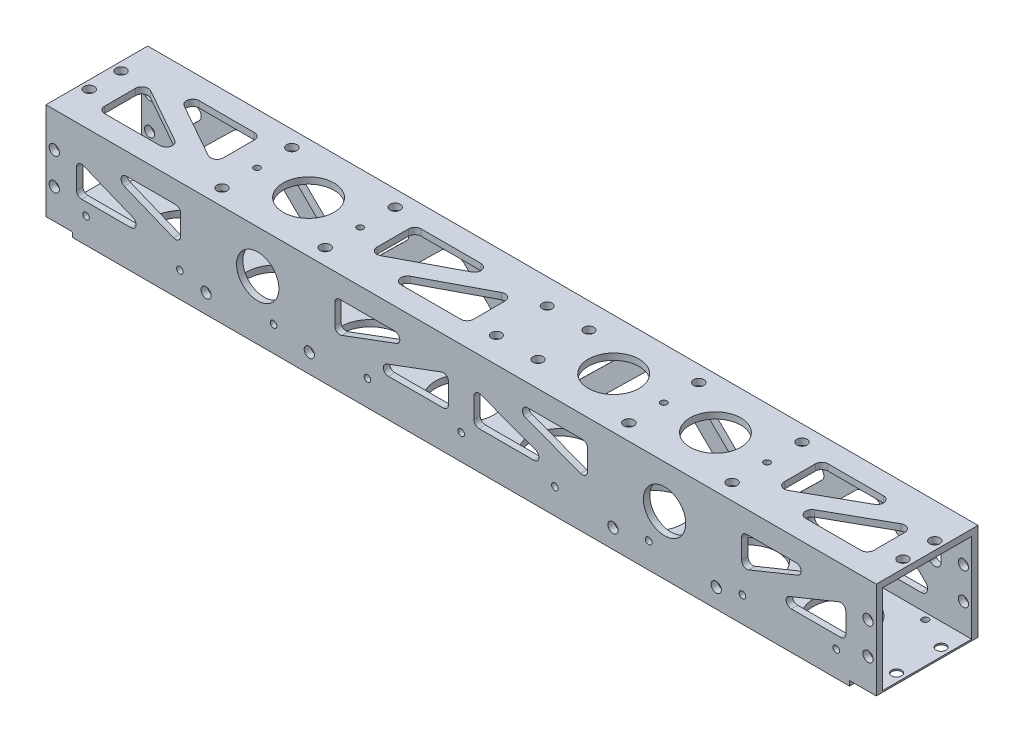
from build123d import *

# Parameters (mm, degrees)
SKETCH1_W                   = 50.8
SKETCH1_H                   = 50.8
SKETCH1_W_2                 = 44.45
SKETCH1_H_2                 = 44.45
BOSS_EXTRUDE1_DEPTH         = 207.3275
CUT_EXTRUDE1_DEPTH          = 211.416283249
CUT_EXTRUDE1_DEPTH_BACK     = 211.416283249
SKETCH2_W                   = 13.335
SKETCH2_H                   = 2.413
F_10_CLEARANCE_HOLE1_REACH  = 216.966
F_10_CLEARANCE_HOLE1_BORE_R = 2.5527
F_10_CLEARANCE_HOLE2_D      = 5.1054
F_10_CLEARANCE_HOLE2_DEPTH  = 3.175
F_10_CLEARANCE_HOLE3_D      = 5.1054
F_10_CLEARANCE_HOLE3_DEPTH  = 3.175
F_10_CLEARANCE_HOLE4_D      = 5.1054
HOLE1_D                     = 3.2766
HOLE1_DEPTH                 = 3.175
HOLE1_TIP                   = 0.984389952
HOLE2_D                     = 3.2766
HOLE2_DEPTH                 = 3.175
CUT_EXTRUDE4_REACH          = 216.966
SKETCH19_R                  = 1.5748
F_10_CLEARANCE_HOLE5_D      = 4.9784
F_10_CLEARANCE_HOLE5_DEPTH  = 0.762
CUT_EXTRUDE5_REACH          = 216.966
SKETCH23_R                  = 2.4892
CUT_EXTRUDE7_REACH          = 216.966
FILLET1_R                   = 3.175
CUT_EXTRUDE8_REACH          = 216.966
FILLET2_R                   = 2.54
CUT_EXTRUDE9_REACH          = 216.966
FILLET3_R                   = 3.175
CUT_EXTRUDE10_REACH         = 216.966
SKETCH27_R                  = 14.605
SKETCH28_R                  = 12.7
CUT_EXTRUDE11_DEPTH         = 3.81
SKETCH29_R                  = 10.57275
CUT_EXTRUDE12_DEPTH         = 3.81


with BuildPart() as part:
    # Sketch1 → Boss-Extrude1 (new, symmetric)
    with BuildSketch(Plane(origin=(0, 0, 0), x_dir=(0, 0, -1), z_dir=(1, 0, 0))):
        Rectangle(SKETCH1_W, SKETCH1_H)
        Rectangle(SKETCH1_W_2, SKETCH1_H_2, mode=Mode.SUBTRACT)
    extrude(amount=BOSS_EXTRUDE1_DEPTH, both=True)

    # Sketch2 → Cut-Extrude1 (cut, two sides: drawn at the far end of the back side and taken through both)
    with BuildSketch(Plane.XY.offset(-CUT_EXTRUDE1_DEPTH_BACK)):
        with Locations((-200.66, -24.1935)):
            Rectangle(SKETCH2_W, SKETCH2_H)
        with Locations((200.66, -24.1935)):
            Rectangle(SKETCH2_W, SKETCH2_H)
    extrude(amount=CUT_EXTRUDE1_DEPTH + CUT_EXTRUDE1_DEPTH_BACK, mode=Mode.SUBTRACT)

    # #10 Clearance Hole1 bore → #10 Clearance Hole1 (cut, up to next)
    with BuildSketch(Plane(origin=(0, 25.4, 0), x_dir=(-1, 0, 0), z_dir=(0, 1, 0)), mode=Mode.PRIVATE) as f_10_clearance_hole1_sk1:
        with Locations((127.381, 17.4625)):
            Circle(F_10_CLEARANCE_HOLE1_BORE_R)
    f_10_clearance_hole1_tool1 = extrude(f_10_clearance_hole1_sk1.sketch, amount=-F_10_CLEARANCE_HOLE1_REACH, mode=Mode.PRIVATE) & part.part
    # #10 Clearance Hole1 bore → #10 Clearance Hole1 (cut, up to next)
    with BuildSketch(Plane(origin=(0, 25.4, 0), x_dir=(-1, 0, 0), z_dir=(0, 1, 0)), mode=Mode.PRIVATE) as f_10_clearance_hole1_sk2:
        with Locations((-127.381, -17.4625)):
            Circle(F_10_CLEARANCE_HOLE1_BORE_R)
    f_10_clearance_hole1_tool2 = extrude(f_10_clearance_hole1_sk2.sketch, amount=-F_10_CLEARANCE_HOLE1_REACH, mode=Mode.PRIVATE) & part.part
    # #10 Clearance Hole1 bore → #10 Clearance Hole1 (cut, up to next)
    with BuildSketch(Plane(origin=(0, 25.4, 0), x_dir=(-1, 0, 0), z_dir=(0, 1, 0)), mode=Mode.PRIVATE) as f_10_clearance_hole1_sk3:
        with Locations((-127.381, 17.4625)):
            Circle(F_10_CLEARANCE_HOLE1_BORE_R)
    f_10_clearance_hole1_tool3 = extrude(f_10_clearance_hole1_sk3.sketch, amount=-F_10_CLEARANCE_HOLE1_REACH, mode=Mode.PRIVATE) & part.part
    # #10 Clearance Hole1 bore → #10 Clearance Hole1 (cut, up to next)
    with BuildSketch(Plane(origin=(0, 25.4, 0), x_dir=(-1, 0, 0), z_dir=(0, 1, 0)), mode=Mode.PRIVATE) as f_10_clearance_hole1_sk4:
        with Locations((127.381, -17.4625)):
            Circle(F_10_CLEARANCE_HOLE1_BORE_R)
    f_10_clearance_hole1_tool4 = extrude(f_10_clearance_hole1_sk4.sketch, amount=-F_10_CLEARANCE_HOLE1_REACH, mode=Mode.PRIVATE) & part.part
    # #10 Clearance Hole1 bore → #10 Clearance Hole1 (cut, up to next)
    with BuildSketch(Plane(origin=(0, 25.4, 0), x_dir=(-1, 0, 0), z_dir=(0, 1, 0)), mode=Mode.PRIVATE) as f_10_clearance_hole1_sk5:
        with Locations((75.819, -17.4625)):
            Circle(F_10_CLEARANCE_HOLE1_BORE_R)
    f_10_clearance_hole1_tool5 = extrude(f_10_clearance_hole1_sk5.sketch, amount=-F_10_CLEARANCE_HOLE1_REACH, mode=Mode.PRIVATE) & part.part
    # #10 Clearance Hole1 bore → #10 Clearance Hole1 (cut, up to next)
    with BuildSketch(Plane(origin=(0, 25.4, 0), x_dir=(-1, 0, 0), z_dir=(0, 1, 0)), mode=Mode.PRIVATE) as f_10_clearance_hole1_sk6:
        with Locations((-75.819, 17.4625)):
            Circle(F_10_CLEARANCE_HOLE1_BORE_R)
    f_10_clearance_hole1_tool6 = extrude(f_10_clearance_hole1_sk6.sketch, amount=-F_10_CLEARANCE_HOLE1_REACH, mode=Mode.PRIVATE) & part.part
    # #10 Clearance Hole1 bore → #10 Clearance Hole1 (cut, up to next)
    with BuildSketch(Plane(origin=(0, 25.4, 0), x_dir=(-1, 0, 0), z_dir=(0, 1, 0)), mode=Mode.PRIVATE) as f_10_clearance_hole1_sk7:
        with Locations((-75.819, -17.4625)):
            Circle(F_10_CLEARANCE_HOLE1_BORE_R)
    f_10_clearance_hole1_tool7 = extrude(f_10_clearance_hole1_sk7.sketch, amount=-F_10_CLEARANCE_HOLE1_REACH, mode=Mode.PRIVATE) & part.part
    # #10 Clearance Hole1 bore → #10 Clearance Hole1 (cut, up to next)
    with BuildSketch(Plane(origin=(0, 25.4, 0), x_dir=(-1, 0, 0), z_dir=(0, 1, 0)), mode=Mode.PRIVATE) as f_10_clearance_hole1_sk8:
        with Locations((75.819, 17.4625)):
            Circle(F_10_CLEARANCE_HOLE1_BORE_R)
    f_10_clearance_hole1_tool8 = extrude(f_10_clearance_hole1_sk8.sketch, amount=-F_10_CLEARANCE_HOLE1_REACH, mode=Mode.PRIVATE) & part.part
    add(f_10_clearance_hole1_tool1.solids().sort_by_distance((-127.381, 25.4, 17.4625))[0], mode=Mode.SUBTRACT)
    add(f_10_clearance_hole1_tool2.solids().sort_by_distance((127.381, 25.4, -17.4625))[0], mode=Mode.SUBTRACT)
    add(f_10_clearance_hole1_tool3.solids().sort_by_distance((127.381, 25.4, 17.4625))[0], mode=Mode.SUBTRACT)
    add(f_10_clearance_hole1_tool4.solids().sort_by_distance((-127.381, 25.4, -17.4625))[0], mode=Mode.SUBTRACT)
    add(f_10_clearance_hole1_tool5.solids().sort_by_distance((-75.819, 25.4, -17.4625))[0], mode=Mode.SUBTRACT)
    add(f_10_clearance_hole1_tool6.solids().sort_by_distance((75.819, 25.4, 17.4625))[0], mode=Mode.SUBTRACT)
    add(f_10_clearance_hole1_tool7.solids().sort_by_distance((75.819, 25.4, -17.4625))[0], mode=Mode.SUBTRACT)
    add(f_10_clearance_hole1_tool8.solids().sort_by_distance((-75.819, 25.4, 17.4625))[0], mode=Mode.SUBTRACT)

    # #10 Clearance Hole2
    with Locations(Plane(origin=(0, 0, 25.4), x_dir=(-1, 0, 0), z_dir=(0, 0, 1))):
        with Locations((75.819, 15.875), (-127.381, 15.875), (127.381, 15.875), (-75.819, 15.875)):
            Hole(F_10_CLEARANCE_HOLE2_D / 2, depth=F_10_CLEARANCE_HOLE2_DEPTH)

    # #10 Clearance Hole3
    with Locations(Plane(origin=(0, 25.4, 0), x_dir=(1, 0, 0), z_dir=(0, 1, 0))):
        with Locations((203.2, 7.9375), (-203.2, -7.9375), (-203.2, 7.9375), (203.2, -7.9375)):
            Hole(F_10_CLEARANCE_HOLE3_D / 2, depth=F_10_CLEARANCE_HOLE3_DEPTH)

    # #10 Clearance Hole4 (through all)
    with Locations(Plane.XY.offset(25.4)):
        with Locations((203.2, -7.9375), (-203.2, 7.9375), (-203.2, -7.9375), (203.2, 7.9375)):
            Hole(F_10_CLEARANCE_HOLE4_D / 2)

    # Hole1
    with Locations(Plane(origin=(0, -25.4, 0), x_dir=(-1, 0, 0), z_dir=(0, -1, 0))):
        with Locations((-187.325, 19.05), (187.325, -19.05), (187.325, 19.05), (140.49375, -19.05), (140.49375, 19.05), (93.6625, -19.05), (93.6625, 19.05), (46.83125, -19.05), (46.83125, 19.05), (0, -19.05), (0, 19.05), (-46.83125, -19.05), (-46.83125, 19.05), (-93.6625, -19.05), (-93.6625, 19.05), (-140.49375, -19.05), (-140.49375, 19.05), (-187.325, -19.05)):
            Hole(HOLE1_D / 2, depth=HOLE1_DEPTH)
            with Locations((0, 0, -(HOLE1_DEPTH + HOLE1_TIP / 2))):  # 118° drill point
                Cone(0, HOLE1_D / 2, HOLE1_TIP, mode=Mode.SUBTRACT)

    # Hole2
    with Locations(Plane.XY.offset(25.4)):
        with Locations((-187.325, -12.7), (-140.49375, -12.7), (-93.6625, -12.7), (-46.83125, -12.7), (0, -12.7), (46.83125, -12.7), (93.6625, -12.7), (140.49375, -12.7), (187.325, -12.7)):
            Hole(HOLE2_D / 2, depth=HOLE2_DEPTH)

    # Sketch19 → Cut-Extrude4 (cut, up to next)
    with BuildSketch(Plane(origin=(0, 25.4, 0), x_dir=(1, 0, 0), z_dir=(0, 1, 0)), mode=Mode.PRIVATE) as cut_extrude4_sk1:
        with Locations(Location((127.381, 0, 0), (0, 0, 270))):
            Circle(SKETCH19_R)
    cut_extrude4_tool1 = extrude(cut_extrude4_sk1.sketch, amount=-CUT_EXTRUDE4_REACH, mode=Mode.PRIVATE) & part.part
    # Sketch19 → Cut-Extrude4 (cut, up to next)
    with BuildSketch(Plane(origin=(0, 25.4, 0), x_dir=(1, 0, 0), z_dir=(0, 1, 0)), mode=Mode.PRIVATE) as cut_extrude4_sk2:
        with Locations(Location((-127.381, 0, 0), (0, 0, 270))):
            Circle(SKETCH19_R)
    cut_extrude4_tool2 = extrude(cut_extrude4_sk2.sketch, amount=-CUT_EXTRUDE4_REACH, mode=Mode.PRIVATE) & part.part
    # Sketch19 → Cut-Extrude4 (cut, up to next)
    with BuildSketch(Plane(origin=(0, 25.4, 0), x_dir=(1, 0, 0), z_dir=(0, 1, 0)), mode=Mode.PRIVATE) as cut_extrude4_sk3:
        with Locations(Location((-75.819, 0, 0), (0, 0, 270))):
            Circle(SKETCH19_R)
    cut_extrude4_tool3 = extrude(cut_extrude4_sk3.sketch, amount=-CUT_EXTRUDE4_REACH, mode=Mode.PRIVATE) & part.part
    # Sketch19 → Cut-Extrude4 (cut, up to next)
    with BuildSketch(Plane(origin=(0, 25.4, 0), x_dir=(1, 0, 0), z_dir=(0, 1, 0)), mode=Mode.PRIVATE) as cut_extrude4_sk4:
        with Locations(Location((75.819, 0, 0), (0, 0, 270))):
            Circle(SKETCH19_R)
    cut_extrude4_tool4 = extrude(cut_extrude4_sk4.sketch, amount=-CUT_EXTRUDE4_REACH, mode=Mode.PRIVATE) & part.part
    add(cut_extrude4_tool1.solids().sort_by_distance((127.381, 25.4, 0))[0], mode=Mode.SUBTRACT)
    add(cut_extrude4_tool2.solids().sort_by_distance((-127.381, 25.4, 0))[0], mode=Mode.SUBTRACT)
    add(cut_extrude4_tool3.solids().sort_by_distance((-75.819, 25.4, 0))[0], mode=Mode.SUBTRACT)
    add(cut_extrude4_tool4.solids().sort_by_distance((75.819, 25.4, 0))[0], mode=Mode.SUBTRACT)

    # #10 Clearance Hole5
    with Locations(Plane(origin=(0, -22.987, 0), x_dir=(-1, 0, 0), z_dir=(0, -1, 0))):
        with Locations((-203.2, -11.1125), (-203.2, 11.1125), (203.2, -11.1125), (203.2, 11.1125)):
            Hole(F_10_CLEARANCE_HOLE5_D / 2, depth=F_10_CLEARANCE_HOLE5_DEPTH)

    # Sketch23 → Cut-Extrude5 (cut, up to next)
    with BuildSketch(Plane(origin=(0, 25.4, 0), x_dir=(1, 0, 0), z_dir=(0, 1, 0)), mode=Mode.PRIVATE) as cut_extrude5_sk1:
        with Locations(Location((25.7175, 12.7, 0), (0, 0, 270))):
            Circle(SKETCH23_R)
    cut_extrude5_tool1 = extrude(cut_extrude5_sk1.sketch, amount=-CUT_EXTRUDE5_REACH, mode=Mode.PRIVATE) & part.part
    # Sketch23 → Cut-Extrude5 (cut, up to next)
    with BuildSketch(Plane(origin=(0, 25.4, 0), x_dir=(1, 0, 0), z_dir=(0, 1, 0)), mode=Mode.PRIVATE) as cut_extrude5_sk2:
        with Locations(Location((25.7175, -12.7, 0), (0, 0, 270))):
            Circle(SKETCH23_R)
    cut_extrude5_tool2 = extrude(cut_extrude5_sk2.sketch, amount=-CUT_EXTRUDE5_REACH, mode=Mode.PRIVATE) & part.part
    # Sketch23 → Cut-Extrude5 (cut, up to next)
    with BuildSketch(Plane(origin=(0, 25.4, 0), x_dir=(1, 0, 0), z_dir=(0, 1, 0)), mode=Mode.PRIVATE) as cut_extrude5_sk3:
        with Locations(Location((4.8895, 12.7, 0), (0, 0, 270))):
            Circle(SKETCH23_R)
    cut_extrude5_tool3 = extrude(cut_extrude5_sk3.sketch, amount=-CUT_EXTRUDE5_REACH, mode=Mode.PRIVATE) & part.part
    # Sketch23 → Cut-Extrude5 (cut, up to next)
    with BuildSketch(Plane(origin=(0, 25.4, 0), x_dir=(1, 0, 0), z_dir=(0, 1, 0)), mode=Mode.PRIVATE) as cut_extrude5_sk4:
        with Locations(Location((4.8895, -12.7, 0), (0, 0, 270))):
            Circle(SKETCH23_R)
    cut_extrude5_tool4 = extrude(cut_extrude5_sk4.sketch, amount=-CUT_EXTRUDE5_REACH, mode=Mode.PRIVATE) & part.part
    add(cut_extrude5_tool1.solids().sort_by_distance((25.7175, 25.4, -12.7))[0], mode=Mode.SUBTRACT)
    add(cut_extrude5_tool2.solids().sort_by_distance((25.7175, 25.4, 12.7))[0], mode=Mode.SUBTRACT)
    add(cut_extrude5_tool3.solids().sort_by_distance((4.8895, 25.4, -12.7))[0], mode=Mode.SUBTRACT)
    add(cut_extrude5_tool4.solids().sort_by_distance((4.8895, 25.4, 12.7))[0], mode=Mode.SUBTRACT)

    # Sketch24 → Cut-Extrude7 (cut, up to next)
    with BuildSketch(Plane(origin=(0, 25.4, 0), x_dir=(1, 0, 0), z_dir=(0, 1, 0)), mode=Mode.PRIVATE) as cut_extrude7_sk1:
        Polygon((-53.600823693, -14.605), (-7.8105, -14.605), (-7.8105, 9.578178988), align=None)
    cut_extrude7_tool1 = extrude(cut_extrude7_sk1.sketch, amount=-CUT_EXTRUDE7_REACH, mode=Mode.PRIVATE) & part.part
    # Sketch24 → Cut-Extrude7 (cut, up to next)
    with BuildSketch(Plane(origin=(0, 25.4, 0), x_dir=(1, 0, 0), z_dir=(0, 1, 0)), mode=Mode.PRIVATE) as cut_extrude7_sk2:
        Polygon((-63.119, -9.578178988), (-63.119, 14.605), (-17.328676307, 14.605), align=None)
    cut_extrude7_tool2 = extrude(cut_extrude7_sk2.sketch, amount=-CUT_EXTRUDE7_REACH, mode=Mode.PRIVATE) & part.part
    # Sketch24 → Cut-Extrude7 (cut, up to next)
    with BuildSketch(Plane(origin=(0, 25.4, 0), x_dir=(1, 0, 0), z_dir=(0, 1, 0)), mode=Mode.PRIVATE) as cut_extrude7_sk3:
        Polygon((-192.0875, -14.605), (-149.157890279, -14.605), (-192.0875, 9.506868708), align=None)
    cut_extrude7_tool3 = extrude(cut_extrude7_sk3.sketch, amount=-CUT_EXTRUDE7_REACH, mode=Mode.PRIVATE) & part.part
    # Sketch24 → Cut-Extrude7 (cut, up to next)
    with BuildSketch(Plane(origin=(0, 25.4, 0), x_dir=(1, 0, 0), z_dir=(0, 1, 0)), mode=Mode.PRIVATE) as cut_extrude7_sk4:
        Polygon((-183.010609721, 14.605), (-140.081, 14.605), (-140.081, -9.506868708), align=None)
    cut_extrude7_tool4 = extrude(cut_extrude7_sk4.sketch, amount=-CUT_EXTRUDE7_REACH, mode=Mode.PRIVATE) & part.part
    # Sketch24 → Cut-Extrude7 (cut, up to next)
    with BuildSketch(Plane(origin=(0, 25.4, 0), x_dir=(1, 0, 0), z_dir=(0, 1, 0)), mode=Mode.PRIVATE) as cut_extrude7_sk5:
        Polygon((149.157890279, -14.605), (192.0875, -14.605), (192.0875, 9.506868708), align=None)
    cut_extrude7_tool5 = extrude(cut_extrude7_sk5.sketch, amount=-CUT_EXTRUDE7_REACH, mode=Mode.PRIVATE) & part.part
    # Sketch24 → Cut-Extrude7 (cut, up to next)
    with BuildSketch(Plane(origin=(0, 25.4, 0), x_dir=(1, 0, 0), z_dir=(0, 1, 0)), mode=Mode.PRIVATE) as cut_extrude7_sk6:
        Polygon((140.081, -9.506868708), (140.081, 14.605), (183.010609721, 14.605), align=None)
    cut_extrude7_tool6 = extrude(cut_extrude7_sk6.sketch, amount=-CUT_EXTRUDE7_REACH, mode=Mode.PRIVATE) & part.part
    add(cut_extrude7_tool1.solids().sort_by_distance((-23.073941, 25.4, 6.54394))[0], mode=Mode.SUBTRACT)
    add(cut_extrude7_tool2.solids().sort_by_distance((-47.855559, 25.4, -6.54394))[0], mode=Mode.SUBTRACT)
    add(cut_extrude7_tool3.solids().sort_by_distance((-177.77763, 25.4, 6.56771))[0], mode=Mode.SUBTRACT)
    add(cut_extrude7_tool4.solids().sort_by_distance((-154.39087, 25.4, -6.56771))[0], mode=Mode.SUBTRACT)
    add(cut_extrude7_tool5.solids().sort_by_distance((177.77763, 25.4, 6.56771))[0], mode=Mode.SUBTRACT)
    add(cut_extrude7_tool6.solids().sort_by_distance((154.39087, 25.4, -6.56771))[0], mode=Mode.SUBTRACT)

    # Fillet1
    fillet1_edges = [part.edges().sort_by_distance(p)[0] for p in [
        (-53.600823693, 23.8125, 14.605),
        (-7.8105, 23.8125, 14.605),
        (-7.8105, 23.8125, -9.578178988),
        (140.081, 23.8125, 9.506868708),
        (183.010609721, 23.8125, -14.605),
        (140.081, 23.8125, -14.605),
        (-149.157890279, 23.8125, 14.605),
        (-192.0875, 23.8125, -9.506868708),
        (-192.0875, 23.8125, 14.605),
        (-183.010609721, 23.8125, -14.605),
        (-140.081, 23.8125, 9.506868708),
        (-140.081, 23.8125, -14.605),
        (149.157890279, 23.8125, 14.605),
        (192.0875, 23.8125, 14.605),
        (192.0875, 23.8125, -9.506868708),
        (-63.119, 23.8125, 9.578178988),
        (-17.328676307, 23.8125, -14.605),
        (-63.119, 23.8125, -14.605),
    ]]
    fillet(fillet1_edges, radius=FILLET1_R)

    # Sketch25 → Cut-Extrude8 (cut, up to next)
    with BuildSketch(Plane.XY.offset(25.4), mode=Mode.PRIVATE) as cut_extrude8_sk1:
        Polygon((-192.0875, 9.806626724), (-151.882404543, -6.5405), (-192.0875, -6.5405), align=None)
    cut_extrude8_tool1 = extrude(cut_extrude8_sk1.sketch, amount=-CUT_EXTRUDE8_REACH, mode=Mode.PRIVATE) & part.part
    # Sketch25 → Cut-Extrude8 (cut, up to next)
    with BuildSketch(Plane.XY.offset(25.4), mode=Mode.PRIVATE) as cut_extrude8_sk2:
        Polygon((-180.286095457, 14.605), (-140.081, 14.605), (-140.081, -1.742126724), align=None)
    cut_extrude8_tool2 = extrude(cut_extrude8_sk2.sketch, amount=-CUT_EXTRUDE8_REACH, mode=Mode.PRIVATE) & part.part
    # Sketch25 → Cut-Extrude8 (cut, up to next)
    with BuildSketch(Plane.XY.offset(25.4), mode=Mode.PRIVATE) as cut_extrude8_sk3:
        Polygon((-50.384612712, -6.5405), (-6.35, -6.5405), (-6.35, 9.861654399), align=None)
    cut_extrude8_tool3 = extrude(cut_extrude8_sk3.sketch, amount=-CUT_EXTRUDE8_REACH, mode=Mode.PRIVATE) & part.part
    # Sketch25 → Cut-Extrude8 (cut, up to next)
    with BuildSketch(Plane.XY.offset(25.4), mode=Mode.PRIVATE) as cut_extrude8_sk4:
        Polygon((-63.119, -1.797154399), (-63.119, 14.605), (-19.084387288, 14.605), align=None)
    cut_extrude8_tool4 = extrude(cut_extrude8_sk4.sketch, amount=-CUT_EXTRUDE8_REACH, mode=Mode.PRIVATE) & part.part
    cut_extrude8_1 = cut_extrude8_tool1.solids().sort_by_distance((-178.685802, -1.091458, 25.4))[0]
    add(cut_extrude8_1, mode=Mode.SUBTRACT)
    cut_extrude8_2 = cut_extrude8_tool2.solids().sort_by_distance((-153.482698, 9.155958, 25.4))[0]
    add(cut_extrude8_2, mode=Mode.SUBTRACT)
    cut_extrude8_3 = cut_extrude8_tool3.solids().sort_by_distance((-21.028204, -1.073115, 25.4))[0]
    add(cut_extrude8_3, mode=Mode.SUBTRACT)
    cut_extrude8_4 = cut_extrude8_tool4.solids().sort_by_distance((-48.440796, 9.137615, 25.4))[0]
    add(cut_extrude8_4, mode=Mode.SUBTRACT)
    cut_extrude8 = cut_extrude8_1 + cut_extrude8_2 + cut_extrude8_3 + cut_extrude8_4  # Cut-Extrude8 as one shape, for the pattern or mirror that repeats it

    # Mirror1: Cut-Extrude8 across plane
    add(cut_extrude8.mirror(Plane(origin=(0, 0, 0), x_dir=(0, 0, 1), z_dir=(1, 0, 0))), mode=Mode.SUBTRACT)

    # Fillet2
    fillet2_edges = [part.edges().sort_by_distance(p)[0] for p in [
        (-192.0875, -6.5405, 23.8125),
        (-192.0875, 9.806626724, 23.8125),
        (-151.882404543, -6.5405, 23.8125),
        (-63.119, 14.605, 23.8125),
        (-19.084387288, 14.605, 23.8125),
        (-63.119, -1.797154399, 23.8125),
        (-6.35, 9.861654399, 23.8125),
        (-6.35, -6.5405, 23.8125),
        (-50.384612712, -6.5405, 23.8125),
        (-140.081, 14.605, 23.8125),
        (-140.081, -1.742126724, 23.8125),
        (-180.286095457, 14.605, 23.8125),
        (192.0875, 9.806626724, 23.8125),
        (192.0875, -6.5405, 23.8125),
        (151.882404543, -6.5405, 23.8125),
        (19.084387288, 14.605, 23.8125),
        (63.119, 14.605, 23.8125),
        (63.119, -1.797154399, 23.8125),
        (6.35, -6.5405, 23.8125),
        (6.35, 9.861654399, 23.8125),
        (50.384612712, -6.5405, 23.8125),
        (140.081, -1.742126724, 23.8125),
        (140.081, 14.605, 23.8125),
        (180.286095457, 14.605, 23.8125),
    ]]
    fillet(fillet2_edges, radius=FILLET2_R)

    # Sketch26 → Cut-Extrude9 (cut, up to next)
    with BuildSketch(Plane(origin=(0, 0, -25.4), x_dir=(-1, 0, 0), z_dir=(0, 0, -1)), mode=Mode.PRIVATE) as cut_extrude9_sk1:
        Polygon((-150.831695796, 14.605), (-121.028367671, -14.605), (-189.962882329, -14.605), (-160.159554204, 14.605), align=None)
    cut_extrude9_tool1 = extrude(cut_extrude9_sk1.sketch, amount=-CUT_EXTRUDE9_REACH, mode=Mode.PRIVATE) & part.part
    # Sketch26 → Cut-Extrude9 (cut, up to next)
    with BuildSketch(Plane(origin=(0, 0, -25.4), x_dir=(-1, 0, 0), z_dir=(0, 0, -1)), mode=Mode.PRIVATE) as cut_extrude9_sk2:
        Polygon((-86.299132329, -14.605), (-56.495804204, 14.605), (-47.167945796, 14.605), (-17.364617671, -14.605), align=None)
    cut_extrude9_tool2 = extrude(cut_extrude9_sk2.sketch, amount=-CUT_EXTRUDE9_REACH, mode=Mode.PRIVATE) & part.part
    # Sketch26 → Cut-Extrude9 (cut, up to next)
    with BuildSketch(Plane(origin=(0, 0, -25.4), x_dir=(-1, 0, 0), z_dir=(0, 0, -1)), mode=Mode.PRIVATE) as cut_extrude9_sk3:
        Polygon((17.364617671, -14.605), (47.167945796, 14.605), (56.495804204, 14.605), (86.299132329, -14.605), align=None)
    cut_extrude9_tool3 = extrude(cut_extrude9_sk3.sketch, amount=-CUT_EXTRUDE9_REACH, mode=Mode.PRIVATE) & part.part
    # Sketch26 → Cut-Extrude9 (cut, up to next)
    with BuildSketch(Plane(origin=(0, 0, -25.4), x_dir=(-1, 0, 0), z_dir=(0, 0, -1)), mode=Mode.PRIVATE) as cut_extrude9_sk4:
        Polygon((160.159554204, 14.605), (189.962882329, -14.605), (121.028367671, -14.605), (150.831695796, 14.605), align=None)
    cut_extrude9_tool4 = extrude(cut_extrude9_sk4.sketch, amount=-CUT_EXTRUDE9_REACH, mode=Mode.PRIVATE) & part.part
    # Sketch26 → Cut-Extrude9 (cut, up to next)
    with BuildSketch(Plane(origin=(0, 0, -25.4), x_dir=(-1, 0, 0), z_dir=(0, 0, -1)), mode=Mode.PRIVATE) as cut_extrude9_sk5:
        Polygon((-138.131007329, 14.605), (-108.327679204, -14.605), (-98.999820796, -14.605), (-69.196492671, 14.605), align=None)
    cut_extrude9_tool5 = extrude(cut_extrude9_sk5.sketch, amount=-CUT_EXTRUDE9_REACH, mode=Mode.PRIVATE) & part.part
    # Sketch26 → Cut-Extrude9 (cut, up to next)
    with BuildSketch(Plane(origin=(0, 0, -25.4), x_dir=(-1, 0, 0), z_dir=(0, 0, -1)), mode=Mode.PRIVATE) as cut_extrude9_sk6:
        Polygon((-34.467257329, 14.605), (-4.663929204, -14.605), (4.663929204, -14.605), (34.467257329, 14.605), align=None)
    cut_extrude9_tool6 = extrude(cut_extrude9_sk6.sketch, amount=-CUT_EXTRUDE9_REACH, mode=Mode.PRIVATE) & part.part
    # Sketch26 → Cut-Extrude9 (cut, up to next)
    with BuildSketch(Plane(origin=(0, 0, -25.4), x_dir=(-1, 0, 0), z_dir=(0, 0, -1)), mode=Mode.PRIVATE) as cut_extrude9_sk7:
        Polygon((108.327679204, -14.605), (138.131007329, 14.605), (69.196492671, 14.605), (98.999820796, -14.605), align=None)
    cut_extrude9_tool7 = extrude(cut_extrude9_sk7.sketch, amount=-CUT_EXTRUDE9_REACH, mode=Mode.PRIVATE) & part.part
    # Sketch26 → Cut-Extrude9 (cut, up to next)
    with BuildSketch(Plane(origin=(0, 0, -25.4), x_dir=(-1, 0, 0), z_dir=(0, 0, -1)), mode=Mode.PRIVATE) as cut_extrude9_sk8:
        Polygon((172.860242671, 14.605), (192.0875, -4.239478853), (192.0875, 14.605), align=None)
    cut_extrude9_tool8 = extrude(cut_extrude9_sk8.sketch, amount=-CUT_EXTRUDE9_REACH, mode=Mode.PRIVATE) & part.part
    # Sketch26 → Cut-Extrude9 (cut, up to next)
    with BuildSketch(Plane(origin=(0, 0, -25.4), x_dir=(-1, 0, 0), z_dir=(0, 0, -1)), mode=Mode.PRIVATE) as cut_extrude9_sk9:
        Polygon((-192.0875, -4.239478853), (-172.860242671, 14.605), (-192.0875, 14.605), align=None)
    cut_extrude9_tool9 = extrude(cut_extrude9_sk9.sketch, amount=-CUT_EXTRUDE9_REACH, mode=Mode.PRIVATE) & part.part
    add(cut_extrude9_tool1.solids().sort_by_distance((155.495625, -3.707849, -25.4))[0], mode=Mode.SUBTRACT)
    add(cut_extrude9_tool2.solids().sort_by_distance((51.831875, -3.707849, -25.4))[0], mode=Mode.SUBTRACT)
    add(cut_extrude9_tool3.solids().sort_by_distance((-51.831875, -3.707849, -25.4))[0], mode=Mode.SUBTRACT)
    add(cut_extrude9_tool4.solids().sort_by_distance((-155.495625, -3.707849, -25.4))[0], mode=Mode.SUBTRACT)
    add(cut_extrude9_tool5.solids().sort_by_distance((103.66375, 3.707849, -25.4))[0], mode=Mode.SUBTRACT)
    add(cut_extrude9_tool6.solids().sort_by_distance((0, 3.707849, -25.4))[0], mode=Mode.SUBTRACT)
    add(cut_extrude9_tool7.solids().sort_by_distance((-103.66375, 3.707849, -25.4))[0], mode=Mode.SUBTRACT)
    add(cut_extrude9_tool8.solids().sort_by_distance((-185.678414, 8.323507, -25.4))[0], mode=Mode.SUBTRACT)
    add(cut_extrude9_tool9.solids().sort_by_distance((185.678414, 8.323507, -25.4))[0], mode=Mode.SUBTRACT)

    # Fillet3
    fillet3_edges = [part.edges().sort_by_distance(p)[0] for p in [
        (34.467257329, 14.605, -23.8125),
        (-34.467257329, 14.605, -23.8125),
        (-86.299132329, -14.605, -23.8125),
        (-17.364617671, -14.605, -23.8125),
        (-47.167945796, 14.605, -23.8125),
        (-56.495804204, 14.605, -23.8125),
        (-172.860242671, 14.605, -23.8125),
        (-192.0875, 14.605, -23.8125),
        (-192.0875, -4.239478853, -23.8125),
        (108.327679204, -14.605, -23.8125),
        (98.999820796, -14.605, -23.8125),
        (69.196492671, 14.605, -23.8125),
        (138.131007329, 14.605, -23.8125),
        (47.167945796, 14.605, -23.8125),
        (56.495804204, 14.605, -23.8125),
        (17.364617671, -14.605, -23.8125),
        (86.299132329, -14.605, -23.8125),
        (192.0875, -4.239478853, -23.8125),
        (192.0875, 14.605, -23.8125),
        (172.860242671, 14.605, -23.8125),
        (189.962882329, -14.605, -23.8125),
        (121.028367671, -14.605, -23.8125),
        (160.159554204, 14.605, -23.8125),
        (150.831695796, 14.605, -23.8125),
        (-98.999820796, -14.605, -23.8125),
        (-108.327679204, -14.605, -23.8125),
        (-138.131007329, 14.605, -23.8125),
        (-69.196492671, 14.605, -23.8125),
        (-150.831695796, 14.605, -23.8125),
        (-160.159554204, 14.605, -23.8125),
        (-189.962882329, -14.605, -23.8125),
        (-121.028367671, -14.605, -23.8125),
        (4.663929204, -14.605, -23.8125),
        (-4.663929204, -14.605, -23.8125),
    ]]
    fillet(fillet3_edges, radius=FILLET3_R)

    # Sketch27 → Cut-Extrude10 (cut, up to next)
    with BuildSketch(Plane.XZ.offset(25.4), mode=Mode.PRIVATE) as cut_extrude10_sk1:
        with Locations(Location((-165.1, 0, 0), (0, 0, 270))):
            Circle(SKETCH27_R)
    cut_extrude10_tool1 = extrude(cut_extrude10_sk1.sketch, amount=-CUT_EXTRUDE10_REACH, mode=Mode.PRIVATE) & part.part
    # Sketch27 → Cut-Extrude10 (cut, up to next)
    with BuildSketch(Plane.XZ.offset(25.4), mode=Mode.PRIVATE) as cut_extrude10_sk2:
        with Locations(Location((-117.928571429, 0, 0), (0, 0, 270))):
            Circle(SKETCH27_R)
    cut_extrude10_tool2 = extrude(cut_extrude10_sk2.sketch, amount=-CUT_EXTRUDE10_REACH, mode=Mode.PRIVATE) & part.part
    # Sketch27 → Cut-Extrude10 (cut, up to next)
    with BuildSketch(Plane.XZ.offset(25.4), mode=Mode.PRIVATE) as cut_extrude10_sk3:
        with Locations(Location((-70.757142857, 0, 0), (0, 0, 270))):
            Circle(SKETCH27_R)
    cut_extrude10_tool3 = extrude(cut_extrude10_sk3.sketch, amount=-CUT_EXTRUDE10_REACH, mode=Mode.PRIVATE) & part.part
    # Sketch27 → Cut-Extrude10 (cut, up to next)
    with BuildSketch(Plane.XZ.offset(25.4), mode=Mode.PRIVATE) as cut_extrude10_sk4:
        with Locations(Location((-23.585714286, 0, 0), (0, 0, 270))):
            Circle(SKETCH27_R)
    cut_extrude10_tool4 = extrude(cut_extrude10_sk4.sketch, amount=-CUT_EXTRUDE10_REACH, mode=Mode.PRIVATE) & part.part
    # Sketch27 → Cut-Extrude10 (cut, up to next)
    with BuildSketch(Plane.XZ.offset(25.4), mode=Mode.PRIVATE) as cut_extrude10_sk5:
        with Locations(Location((23.585714286, 0, 0), (0, 0, 270))):
            Circle(SKETCH27_R)
    cut_extrude10_tool5 = extrude(cut_extrude10_sk5.sketch, amount=-CUT_EXTRUDE10_REACH, mode=Mode.PRIVATE) & part.part
    # Sketch27 → Cut-Extrude10 (cut, up to next)
    with BuildSketch(Plane.XZ.offset(25.4), mode=Mode.PRIVATE) as cut_extrude10_sk6:
        with Locations(Location((70.757142857, 0, 0), (0, 0, 270))):
            Circle(SKETCH27_R)
    cut_extrude10_tool6 = extrude(cut_extrude10_sk6.sketch, amount=-CUT_EXTRUDE10_REACH, mode=Mode.PRIVATE) & part.part
    # Sketch27 → Cut-Extrude10 (cut, up to next)
    with BuildSketch(Plane.XZ.offset(25.4), mode=Mode.PRIVATE) as cut_extrude10_sk7:
        with Locations(Location((117.928571429, 0, 0), (0, 0, 270))):
            Circle(SKETCH27_R)
    cut_extrude10_tool7 = extrude(cut_extrude10_sk7.sketch, amount=-CUT_EXTRUDE10_REACH, mode=Mode.PRIVATE) & part.part
    # Sketch27 → Cut-Extrude10 (cut, up to next)
    with BuildSketch(Plane.XZ.offset(25.4), mode=Mode.PRIVATE) as cut_extrude10_sk8:
        with Locations(Location((165.1, 0, 0), (0, 0, 270))):
            Circle(SKETCH27_R)
    cut_extrude10_tool8 = extrude(cut_extrude10_sk8.sketch, amount=-CUT_EXTRUDE10_REACH, mode=Mode.PRIVATE) & part.part
    add(cut_extrude10_tool1.solids().sort_by_distance((-165.1, -25.4, 0))[0], mode=Mode.SUBTRACT)
    add(cut_extrude10_tool2.solids().sort_by_distance((-117.928571, -25.4, 0))[0], mode=Mode.SUBTRACT)
    add(cut_extrude10_tool3.solids().sort_by_distance((-70.757143, -25.4, 0))[0], mode=Mode.SUBTRACT)
    add(cut_extrude10_tool4.solids().sort_by_distance((-23.585714, -25.4, 0))[0], mode=Mode.SUBTRACT)
    add(cut_extrude10_tool5.solids().sort_by_distance((23.585714, -25.4, 0))[0], mode=Mode.SUBTRACT)
    add(cut_extrude10_tool6.solids().sort_by_distance((70.757143, -25.4, 0))[0], mode=Mode.SUBTRACT)
    add(cut_extrude10_tool7.solids().sort_by_distance((117.928571, -25.4, 0))[0], mode=Mode.SUBTRACT)
    add(cut_extrude10_tool8.solids().sort_by_distance((165.1, -25.4, 0))[0], mode=Mode.SUBTRACT)

    # Sketch28 → Cut-Extrude11 (cut)
    with BuildSketch(Plane(origin=(0, 25.4, 0), x_dir=(1, 0, 0), z_dir=(0, 1, 0))):
        with Locations(Location((101.6, 0, 0), (0, 0, 270))):
            Circle(SKETCH28_R)
        with Locations(Location((50.76825, 0, 0), (0, 0, 270))):
            Circle(SKETCH28_R)
        with Locations(Location((-101.6, 0, 0), (0, 0, 270))):
            Circle(SKETCH28_R)
    extrude(amount=-CUT_EXTRUDE11_DEPTH, mode=Mode.SUBTRACT)

    # Sketch29 → Cut-Extrude12 (cut)
    with BuildSketch(Plane.XY.offset(25.4)):
        with Locations((-101.6, 4.03225)):
            Circle(SKETCH29_R)
        with Locations((101.6, 4.03225)):
            Circle(SKETCH29_R)
    extrude(amount=-CUT_EXTRUDE12_DEPTH, mode=Mode.SUBTRACT)


solid = part.part
